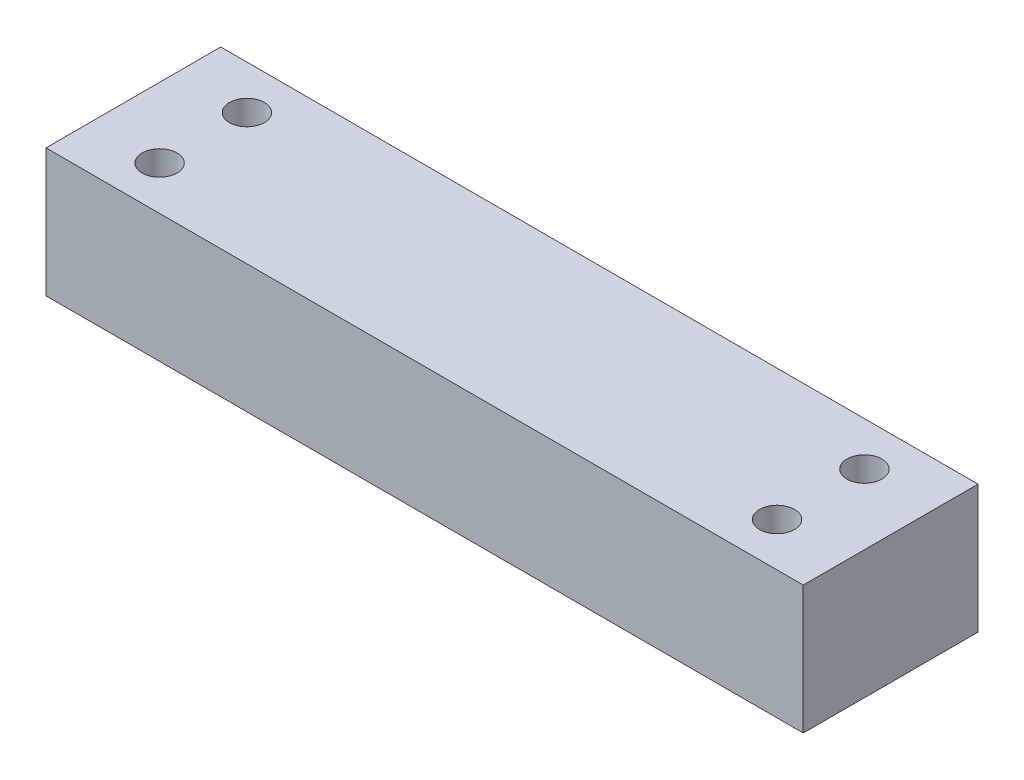
from build123d import *

# Parameters (mm, degrees)
SKETCH1_W           = 130
SKETCH1_H           = 30
SKETCH1_R           = 3
BOSS_EXTRUDE1_DEPTH = 22


with BuildPart() as part:
    # Sketch1 → Boss-Extrude1 (new body)
    with BuildSketch(Plane(origin=(0, 0, 0), x_dir=(1, 0, 0), z_dir=(0, 1, 0))):
        Rectangle(SKETCH1_W, SKETCH1_H)
        with Locations(Location((-53, 7.5, 0), (0, 0, 270))):
            Circle(SKETCH1_R, mode=Mode.SUBTRACT)
        with Locations(Location((-53, -7.5, 0), (0, 0, 270))):
            Circle(SKETCH1_R, mode=Mode.SUBTRACT)
        with Locations(Location((53, 7.5, 0), (0, 0, 270))):
            Circle(SKETCH1_R, mode=Mode.SUBTRACT)
        with Locations(Location((53, -7.5, 0), (0, 0, 270))):
            Circle(SKETCH1_R, mode=Mode.SUBTRACT)
    extrude(amount=BOSS_EXTRUDE1_DEPTH)


solid = part.part
